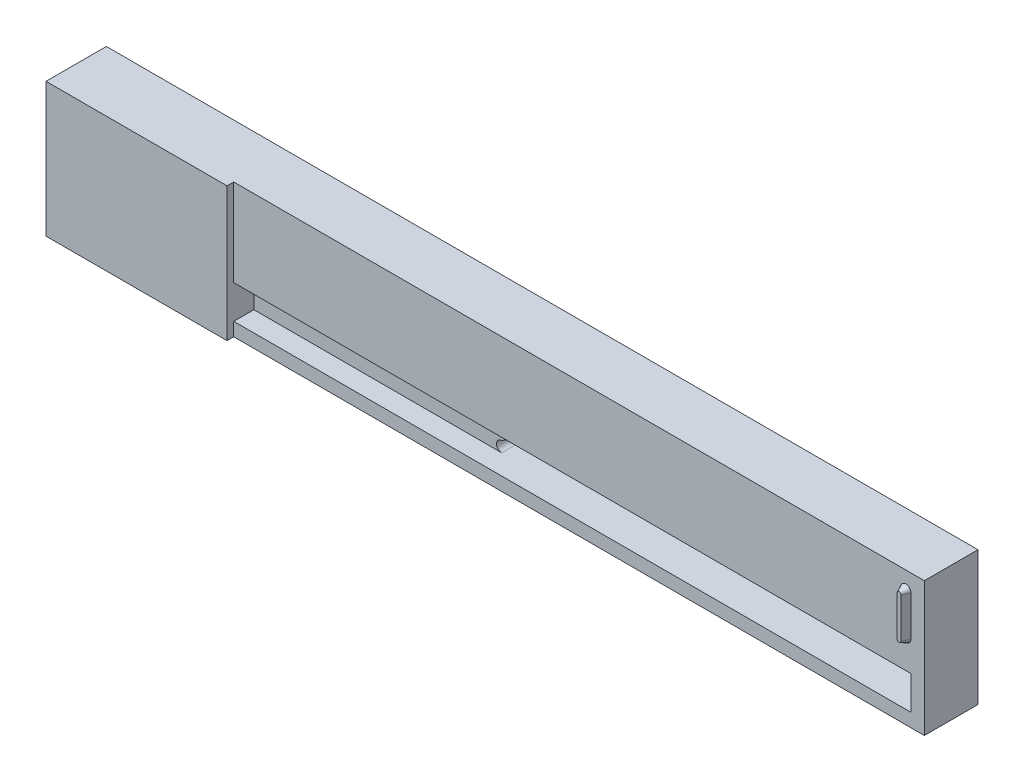
from build123d import *

# Parameters (mm, degrees)
SKETCH1_W           = 130
SKETCH1_H           = 20
BOSS_EXTRUDE1_DEPTH = 8
SKETCH2_W           = 3
SKETCH2_H           = 13.5
CUT_EXTRUDE1_DEPTH  = 7
SKETCH3_W           = 27
SKETCH3_H           = 20
BOSS_EXTRUDE2_DEPTH = 1
CUT_EXTRUDE3_DEPTH  = 2
CUT_EXTRUDE4_DEPTH  = 7
SKETCH7_R           = 3.15
CUT_EXTRUDE5_DEPTH  = 3
BOSS_EXTRUDE3_DEPTH = 1.5
CIRPATTERN1_COUNT   = 8
SKETCH9_R           = 1
CUT_EXTRUDE6_DEPTH  = 1
CUT_EXTRUDE6_DRAFT  = -25
SKETCH10_R          = 0.5
CUT_EXTRUDE7_DEPTH  = 3
SKETCH11_W          = 101
SKETCH11_H          = 5
CUT_EXTRUDE8_DEPTH  = 3
BOSS_EXTRUDE5_DEPTH = 5
LPATTERN2_COUNT     = 5
LPATTERN2_PITCH     = 1
BOSS_EXTRUDE6_DEPTH = 5
LPATTERN3_COUNT     = 3
LPATTERN3_PITCH     = 1
BOSS_EXTRUDE7_DEPTH = 1
BOSS_EXTRUDE7_TAPER = 25
SKETCH18_W          = 0.569871795
SKETCH18_H          = 4.640384615
SKETCH18_H_2        = 6.512820512
CUT_EXTRUDE10_DEPTH = 1


with BuildPart() as part:
    # Sketch1 → Boss-Extrude1 (new body)
    with BuildSketch(Plane.XY):
        Rectangle(SKETCH1_W, SKETCH1_H)
    extrude(amount=BOSS_EXTRUDE1_DEPTH)

    # Sketch2 → Cut-Extrude1 (cut)
    with BuildSketch(Plane.ZY.offset(65)):
        with Locations((3.1, 0.45)):
            Rectangle(SKETCH2_W, SKETCH2_H)
    extrude(amount=-CUT_EXTRUDE1_DEPTH, mode=Mode.SUBTRACT)

    # Sketch3 → Boss-Extrude2 (add)
    with BuildSketch(Plane.XY.offset(8)):
        with Locations((-51.5, 0)):
            Rectangle(SKETCH3_W, SKETCH3_H)
    extrude(amount=BOSS_EXTRUDE2_DEPTH)

    # Sketch4 → Cut-Extrude3 (cut)
    with BuildSketch(Plane(origin=(0, 0, 0), x_dir=(-1, 0, 0), z_dir=(0, 0, -1))):
        Polygon((-4, -9), (7, -9), (-4, -2), (-64, -2), (-64, -9), align=None)
    extrude(amount=-CUT_EXTRUDE3_DEPTH, mode=Mode.SUBTRACT)

    # Sketch6 → Cut-Extrude4 (cut)
    with BuildSketch(Plane(origin=(0, 0, 2), x_dir=(-1, 0, 0), z_dir=(0, 0, -1))):
        with BuildLine():
            Line((-63, -3), (-4, -3))
            Line((-4, -3), (1.029142106, -6.427272248))
            ThreePointArc((1.029142106, -6.427272248), (1.815505982, -7.213636124), (1.029142106, -8))
            Line((1.029142106, -8), (-4, -8))
            Line((-4, -8), (-63, -8))
            Line((-63, -8), (-63, -3))
        make_face()
    extrude(amount=-CUT_EXTRUDE4_DEPTH, mode=Mode.SUBTRACT)

    # Sketch7 → Cut-Extrude5 (cut)
    with BuildSketch(Plane(origin=(0, 0, 0), x_dir=(-1, 0, 0), z_dir=(0, 0, -1))):
        with Locations((-46, 4)):
            Circle(SKETCH7_R)
    extrude(amount=-CUT_EXTRUDE5_DEPTH, mode=Mode.SUBTRACT)

    # Sketch8 → Boss-Extrude3 (add)
    with BuildSketch(Plane(origin=(0, 0, 3), x_dir=(-1, 0, 0), z_dir=(0, 0, -1))):
        with BuildLine():
            Line((-46, 4), (-46, 6))
            ThreePointArc((-46, 6), (-45, 6.414213562), (-44.585786438, 5.414213562))
            Line((-44.585786438, 5.414213562), (-46, 4))
        make_face()
    boss_extrude3 = extrude(amount=BOSS_EXTRUDE3_DEPTH)

    # CirPattern1: Boss-Extrude3 ×8 about axis
    cirpattern1_axis = Axis((46, 4, 0), (0, 0, 1))
    for i in range(1, CIRPATTERN1_COUNT):
        add(boss_extrude3.rotate(cirpattern1_axis, i * 360 / CIRPATTERN1_COUNT))


with BuildPart() as cut_extrude6_tool:
    # Sketch9 → Cut-Extrude6 (with draft: the straight prism first)
    with BuildSketch(Plane(origin=(0, 0, 1.5), x_dir=(-1, 0, 0), z_dir=(0, 0, -1))):
        with Locations((-46, 4)):
            Circle(SKETCH9_R)
    extrude(amount=-CUT_EXTRUDE6_DEPTH)
    # Cut-Extrude6: the draft: its side faces are tilted about the plane it starts from
    cut_extrude6_sides = [cut_extrude6_tool.faces().sort_by_distance(p)[0] for p in [
        (47, 4, 2),
    ]]
    draft(cut_extrude6_sides, Plane(origin=(0, 0, 1.5), x_dir=(-1, 0, 0), z_dir=(0, 0, -1)), CUT_EXTRUDE6_DRAFT)


with BuildPart() as part_1:
    add(part.part)

    # Cut-Extrude6: cut by cut_extrude6_tool
    add(cut_extrude6_tool.part, mode=Mode.SUBTRACT)

    # Sketch10 → Cut-Extrude7 (cut)
    with BuildSketch(Plane(origin=(0, 0, 0), x_dir=(-1, 0, 0), z_dir=(0, 0, -1))):
        with Locations((-54.346544303, 4)):
            Circle(SKETCH10_R)
    extrude(amount=-CUT_EXTRUDE7_DEPTH, mode=Mode.SUBTRACT)

    # Sketch11 → Cut-Extrude8 (cut)
    with BuildSketch(Plane.XY.offset(8)):
        with Locations((12.5, -5.5)):
            Rectangle(SKETCH11_W, SKETCH11_H)
    extrude(amount=-CUT_EXTRUDE8_DEPTH, mode=Mode.SUBTRACT)

    # Sketch13 → Boss-Extrude5 (add)
    with BuildSketch(Plane.ZY.offset(58)):
        with BuildLine():
            Line((2.394077923, -5.196267403), (2.394077923, -4.196267403))
            Line((2.394077923, -4.196267403), (3.296543728, -4.196267403))
            ThreePointArc((3.296543728, -4.196267403), (3.796543728, -4.696267403), (3.296543728, -5.196267403))
            Line((3.296543728, -5.196267403), (2.394077923, -5.196267403))
        make_face()
    boss_extrude5 = extrude(amount=BOSS_EXTRUDE5_DEPTH)

    # LPattern2: Boss-Extrude5 ×5
    with Locations(*[(0, i * LPATTERN2_PITCH, 0) for i in range(1, LPATTERN2_COUNT)]):
        add(boss_extrude5)

    # Sketch15 → Boss-Extrude6 (add)
    with BuildSketch(Plane.ZY.offset(58)):
        with BuildLine():
            Line((2.394077923, 2.550445293), (2.394077923, 3.550445293))
            Line((2.394077923, 3.550445293), (3.394077923, 3.550445293))
            ThreePointArc((3.394077923, 3.550445293), (3.894077923, 3.050445293), (3.394077923, 2.550445293))
            Line((3.394077923, 2.550445293), (2.394077923, 2.550445293))
        make_face()
    boss_extrude6 = extrude(amount=BOSS_EXTRUDE6_DEPTH)

    # LPattern3: Boss-Extrude6 ×3
    with Locations(*[(0, i * LPATTERN3_PITCH, 0) for i in range(1, LPATTERN3_COUNT)]):
        add(boss_extrude6)

    # Sketch16 → Boss-Extrude7 (add)
    with BuildSketch(Plane.XY.offset(8)):
        with BuildLine():
            Line((63, 1.437655511), (63, 7.437655511))
            ThreePointArc((63, 7.437655511), (62.243555183, 8.194100328), (61.487110367, 7.437655511))
            Line((61.487110367, 7.437655511), (61.487110367, 1.437655511))
            ThreePointArc((61.487110367, 1.437655511), (62.243555183, 0.681210694), (63, 1.437655511))
        make_face()
    extrude(amount=BOSS_EXTRUDE7_DEPTH, taper=BOSS_EXTRUDE7_TAPER)

    # Sketch18 → Cut-Extrude10 (cut)
    # profile 1 of 6: a face of its own
    with BuildSketch(Plane(origin=(0, 0, 0), x_dir=(-1, 0, 0), z_dir=(0, 0, -1))):
        with BuildLine():
            add(Edge.make_bspline(
                [(33.830181075, 3.951769435), (33.865543891, 3.950129044), (33.934791076, 3.946916844), (34.034927433, 3.919409593), (34.126108012, 3.87278302), (34.206984756, 3.810227028), (34.276384608, 3.736658752), (34.324972468, 3.650913852), (34.356200672, 3.558278893), (34.359971766, 3.493662946), (34.361891812, 3.460763826)],
                knots=[0, 0, 0, 0, 1.055194115, 2.066272739, 3.074728998, 4.095836921, 5.109056067, 6.073838105, 7.019297344, 8, 8, 8, 8], degree=3))
            add(Edge.make_bspline(
                [(34.361891812, 3.460763826), (34.359928465, 3.428718727), (34.35604716, 3.365369358), (34.324996589, 3.274340344), (34.275970529, 3.189786858), (34.207029258, 3.116361427), (34.12609622, 3.053840016), (34.034930566, 3.007204276), (33.934790252, 2.979699455), (33.865543612, 2.97648692), (33.830181075, 2.974846358)],
                knots=[0, 0, 0, 0, 0.96129708, 1.900370562, 2.859976407, 3.87933698, 4.906634145, 5.921202961, 6.938410037, 8, 8, 8, 8], degree=3))
            add(Edge.make_bspline(
                [(33.830181075, 2.974846358), (33.795222919, 2.976424279), (33.727181435, 2.979495496), (33.628544449, 3.007743957), (33.538141333, 3.053855975), (33.457106855, 3.115952054), (33.389560648, 3.190237796), (33.340396543, 3.274288743), (33.309417684, 3.365382495), (33.305526715, 3.42872314), (33.303558479, 3.460763826)],
                knots=[0, 0, 0, 0, 1.054934014, 2.053291228, 3.073705704, 4.106921865, 5.123545215, 6.088680038, 7.033164197, 8, 8, 8, 8], degree=3))
            add(Edge.make_bspline(
                [(33.303558479, 3.460763826), (33.305483593, 3.493658367), (33.309264639, 3.558265322), (33.340419764, 3.65096631), (33.38915113, 3.736204178), (33.457151581, 3.810636156), (33.53812943, 3.872767159), (33.628547525, 3.918869939), (33.727180622, 3.947120798), (33.795222643, 3.950191684), (33.830181075, 3.951769435)],
                knots=[0, 0, 0, 0, 0.98631895, 1.937192651, 2.907499808, 3.917963147, 4.944918757, 5.95915025, 6.951458133, 8, 8, 8, 8], degree=3))
        make_face()
    # profile 2 of 6: a face of its own
    with BuildSketch(Plane(origin=(0, 0, 0), x_dir=(-1, 0, 0), z_dir=(0, 0, -1))):
        with Locations((33.832725146, -0.322269026)):
            Rectangle(SKETCH18_W, SKETCH18_H)
    # profile 3 of 6: a face of its own
    with BuildSketch(Plane(origin=(0, 0, 0), x_dir=(-1, 0, 0), z_dir=(0, 0, -1))):
        with BuildLine():
            Line((35.501635402, 1.997923281), (36.071507197, 1.997923281))
            Line((36.071507197, 1.997923281), (36.071507197, 1.160924082))
            add(Edge.make_bspline(
                [(36.071507197, 1.160924082), (36.132354049, 1.236838737), (36.250429489, 1.384153772), (36.447069637, 1.577775386), (36.654884999, 1.737333151), (36.872602919, 1.864521463), (37.100518952, 1.960400342), (37.337243813, 2.029644245), (37.58419478, 2.071163863), (37.752133115, 2.076588995), (37.837092133, 2.079333537)],
                knots=[0, 0, 0, 0, 1.12780773, 2.188550248, 3.19190651, 4.159438251, 5.104880172, 6.052711206, 7.014878035, 8, 8, 8, 8], degree=3))
            add(Edge.make_bspline(
                [(37.837092133, 2.079333537), (37.922963426, 2.076167254), (38.091034261, 2.069970074), (38.335741601, 2.020954078), (38.564293329, 1.9372334), (38.775874523, 1.822548644), (38.966605325, 1.679934042), (39.134108984, 1.513785781), (39.272653732, 1.32267603), (39.365540377, 1.145378304), (39.426728338, 0.988100063), (39.465249864, 0.853395245), (39.497963216, 0.703320885), (39.526323673, 0.538330488), (39.545513576, 0.357268057), (39.560648877, 0.160875815), (39.571495936, -0.050782621), (39.571926298, -0.197171217), (39.572148223, -0.272659652)],
                knots=[0, 0, 0, 0, 1.235846778, 2.418850247, 3.575807741, 4.728682307, 5.871620074, 6.994088408, 8.11269785, 9.256955736, 9.865816715, 10.540099792, 11.271859618, 12.076849838, 12.949306005, 13.892391288, 14.913166135, 16, 16, 16, 16], degree=3))
            Line((39.572148223, -0.272659652), (39.572148223, -2.642461334))
            Line((39.572148223, -2.642461334), (39.002276428, -2.642461334))
            Line((39.002276428, -2.642461334), (39.002276428, -0.459648834))
            add(Edge.make_bspline(
                [(39.002276428, -0.459648834), (39.001925893, -0.39647097), (39.00125538, -0.275622468), (38.999140564, -0.102595811), (38.994042772, 0.054315552), (38.986879404, 0.19473649), (38.976394592, 0.318532165), (38.965467818, 0.42595471), (38.952105646, 0.516867737), (38.940198646, 0.571595815), (38.934858559, 0.596140428)],
                knots=[0, 0, 0, 0, 1.430800155, 2.736877192, 3.918605307, 4.986035426, 5.920637409, 6.731861385, 7.431261377, 8, 8, 8, 8], degree=3))
            add(Edge.make_bspline(
                [(38.934858559, 0.596140428), (38.915580809, 0.668187864), (38.878477105, 0.806856886), (38.786794021, 0.994951783), (38.671016865, 1.154968495), (38.529687909, 1.28591769), (38.364172301, 1.387827637), (38.174929342, 1.458537526), (37.963785236, 1.502763043), (37.815277999, 1.507166554), (37.737873383, 1.509461743)],
                knots=[0, 0, 0, 0, 1.084156227, 2.086665306, 3.027808233, 3.945421172, 4.874247719, 5.839848303, 6.874090471, 8, 8, 8, 8], degree=3))
            add(Edge.make_bspline(
                [(37.737873383, 1.509461743), (37.692030586, 1.508598134), (37.601308874, 1.506889075), (37.466779639, 1.48974172), (37.336288639, 1.461695665), (37.20852626, 1.423833994), (37.086047834, 1.371832449), (36.964918335, 1.312814877), (36.84969892, 1.239248835), (36.737932756, 1.157260136), (36.633950948, 1.066402146), (36.537198106, 0.970527106), (36.450950555, 0.868427082), (36.372811672, 0.761747177), (36.30535968, 0.649022271), (36.246480506, 0.531339887), (36.196522888, 0.408545131), (36.171698575, 0.323318948), (36.15927763, 0.280675685)],
                knots=[0, 0, 0, 0, 1.023777757, 2.026029729, 3.023749952, 4.003683103, 4.997618607, 5.993177895, 7.010360494, 8.046726602, 9.087585522, 10.09234134, 11.086953743, 12.070360549, 13.043493632, 14.017870808, 15.008233677, 16, 16, 16, 16], degree=3))
            add(Edge.make_bspline(
                [(36.15927763, 0.280675685), (36.152129982, 0.249369816), (36.136569926, 0.181218579), (36.119763871, 0.069377989), (36.104510127, -0.05999868), (36.091743073, -0.206760455), (36.083931818, -0.371421171), (36.075414841, -0.55327762), (36.072314116, -0.753054949), (36.071783702, -0.892141163), (36.071507197, -0.964646831)],
                knots=[0, 0, 0, 0, 0.615963638, 1.340920617, 2.168419149, 3.115676021, 4.16674242, 5.331190069, 6.6087489, 8, 8, 8, 8], degree=3))
            Line((36.071507197, -0.964646831), (36.071507197, -2.642461334))
            Line((36.071507197, -2.642461334), (35.501635402, -2.642461334))
            Line((35.501635402, -2.642461334), (35.501635402, 1.997923281))
        make_face()
    # profile 4 of 6: a face of its own
    with BuildSketch(Plane(origin=(0, 0, 0), x_dir=(-1, 0, 0), z_dir=(0, 0, -1))):
        Polygon((41.44458412, 3.870359178), (42.014455915, 3.870359178), (42.014455915, 1.997923281), (42.828558479, 1.997923281), (42.828558479, 1.428051486), (42.014455915, 1.428051486), (42.014455915, -2.642461334), (41.44458412, -2.642461334), (41.44458412, 1.428051486), (40.630481556, 1.428051486), (40.630481556, 1.997923281), (41.44458412, 1.997923281), align=None)
    # profile 5 of 6: a face of its own
    with BuildSketch(Plane(origin=(0, 0, 0), x_dir=(-1, 0, 0), z_dir=(0, 0, -1))):
        with BuildLine():
            Line((47.613955114, -1.177076719), (48.120225146, -1.442932088))
            add(Edge.make_bspline(
                [(48.120225146, -1.442932088), (48.079881609, -1.51449356), (48.001389062, -1.653723847), (47.866404848, -1.845007365), (47.724904945, -2.017088221), (47.570502031, -2.165369165), (47.407815614, -2.294639535), (47.235943512, -2.40773816), (47.053990942, -2.504110332), (46.861949299, -2.585304204), (46.658205827, -2.647732858), (46.44226679, -2.691827659), (46.213718506, -2.71908416), (46.057061865, -2.722250344), (45.976845739, -2.723871591)],
                knots=[0, 0, 0, 0, 1.120438281, 2.179929193, 3.190490725, 4.156257408, 5.095198341, 6.022838206, 6.959905092, 7.901321166, 8.864066838, 9.862729781, 10.905609505, 12, 12, 12, 12], degree=3))
            add(Edge.make_bspline(
                [(45.976845739, -2.723871591), (45.887688151, -2.721790287), (45.713767526, -2.717730266), (45.460602556, -2.682728224), (45.222242754, -2.625628373), (44.998701521, -2.545862319), (44.790526292, -2.441672745), (44.597303312, -2.314746257), (44.418016458, -2.165734881), (44.258315393, -1.993347904), (44.114544348, -1.808867782), (43.987678932, -1.616633534), (43.88162045, -1.417128827), (43.795346429, -1.211623733), (43.725669031, -1.001413527), (43.677106583, -0.784585578), (43.649112611, -0.561726733), (43.644822832, -0.410964424), (43.642661043, -0.334989379)],
                knots=[0, 0, 0, 0, 1.145258523, 2.234067595, 3.276747158, 4.290159414, 5.277019952, 6.260822364, 7.254936242, 8.264827045, 9.274100331, 10.257902744, 11.220704747, 12.172965371, 13.118907548, 14.062713208, 15.023725156, 16, 16, 16, 16], degree=3))
            add(Edge.make_bspline(
                [(43.642661043, -0.334989379), (43.644582628, -0.26369733), (43.648390956, -0.122405902), (43.672395384, 0.086718728), (43.714937288, 0.289970349), (43.773314332, 0.487517848), (43.848700165, 0.679030462), (43.940924334, 0.864624749), (44.050130505, 1.044103217), (44.134445213, 1.157320331), (44.176915851, 1.214349563)],
                knots=[0, 0, 0, 0, 1.024358464, 2.0301432, 3.019427413, 4.004406732, 4.986367066, 5.972626655, 6.978780325, 8, 8, 8, 8], degree=3))
            add(Edge.make_bspline(
                [(44.176915851, 1.214349563), (44.234442647, 1.283054513), (44.347673936, 1.418288015), (44.539183323, 1.59597612), (44.746556537, 1.744826969), (44.967194772, 1.868211345), (45.203662375, 1.961962104), (45.452780661, 2.031825861), (45.717386224, 2.070974538), (45.898279982, 2.076504179), (45.990838127, 2.079333537)],
                knots=[0, 0, 0, 0, 1.030682036, 2.02871468, 2.997146059, 3.962720338, 4.930598197, 5.918074684, 6.934738563, 8, 8, 8, 8], degree=3))
            add(Edge.make_bspline(
                [(45.990838127, 2.079333537), (46.085993068, 2.076876906), (46.272665371, 2.072057555), (46.544866505, 2.02737835), (46.802423805, 1.956525858), (47.045234205, 1.856461124), (47.273322324, 1.727357366), (47.485205586, 1.567442882), (47.684507616, 1.381627209), (47.800456037, 1.238728243), (47.859457918, 1.166012223)],
                knots=[0, 0, 0, 0, 1.056321875, 2.072262726, 3.055038591, 4.01806755, 4.982017516, 5.957941055, 6.960871419, 8, 8, 8, 8], degree=3))
            add(Edge.make_bspline(
                [(47.859457918, 1.166012223), (47.899602506, 1.111214297), (47.979624468, 1.001983196), (48.079858492, 0.823872668), (48.166866909, 0.637526304), (48.236413853, 0.439931908), (48.292728376, 0.23343067), (48.333471462, 0.016546339), (48.357364912, -0.210656501), (48.362061549, -0.365463251), (48.364455915, -0.444384411)],
                knots=[0, 0, 0, 0, 0.94817472, 1.890038105, 2.849395472, 3.817997239, 4.812318967, 5.836947057, 6.897266129, 8, 8, 8, 8], degree=3))
            Line((48.364455915, -0.444384411), (44.212532838, -0.444384411))
            add(Edge.make_bspline(
                [(44.212532838, -0.444384411), (44.215326124, -0.505526682), (44.220819008, -0.625760492), (44.246427911, -0.801693198), (44.286793543, -0.969284833), (44.343524557, -1.127278352), (44.412225833, -1.277737298), (44.496382777, -1.419545565), (44.596784539, -1.552057238), (44.708772593, -1.676457616), (44.833426895, -1.787239283), (44.964568451, -1.88639322), (45.104075347, -1.96949766), (45.250847584, -2.036952603), (45.404647823, -2.089759776), (45.56552452, -2.125805679), (45.733161102, -2.149948573), (45.84743522, -2.152633109), (45.905611764, -2.153999796)],
                knots=[0, 0, 0, 0, 1.094153842, 2.151609401, 3.174256925, 4.172055639, 5.149267565, 6.128595816, 7.11444997, 8.118368179, 9.117203808, 10.09244225, 11.054858984, 12.015122123, 12.976791628, 13.957293641, 14.960065497, 16, 16, 16, 16], degree=3))
            add(Edge.make_bspline(
                [(45.905611764, -2.153999796), (45.962491704, -2.152896607), (46.075352414, -2.15070767), (46.243429398, -2.129422631), (46.408782541, -2.095005131), (46.570727468, -2.048033292), (46.725977431, -1.990743861), (46.8697515, -1.92161439), (47.001977034, -1.845142707), (47.125560674, -1.757676582), (47.245432333, -1.650618871), (47.36434513, -1.517022635), (47.491847058, -1.359020977), (47.571656748, -1.240102412), (47.613955114, -1.177076719)],
                knots=[0, 0, 0, 0, 0.99110716, 1.966546729, 2.947904876, 3.932708344, 4.903319531, 5.828989031, 6.710028674, 7.56322171, 8.463672341, 9.504779593, 10.677557249, 12, 12, 12, 12], degree=3))
        make_face()
        with BuildLine():
            add(Edge.make_bspline(
                [(47.79458412, 0.125487384), (47.773725958, 0.20107574), (47.733580711, 0.346558995), (47.649694736, 0.548018896), (47.555222084, 0.727066945), (47.443422657, 0.882332851), (47.31675154, 1.020224938), (47.170438137, 1.140727229), (47.006361588, 1.248527461), (46.825370004, 1.339518425), (46.633705622, 1.416970025), (46.433034388, 1.468904164), (46.228278116, 1.504481476), (46.089785911, 1.507794559), (46.020094937, 1.509461743)],
                knots=[0, 0, 0, 0, 1.154881502, 2.222775134, 3.210006277, 4.132804581, 5.035138423, 5.962687519, 6.919655026, 7.923214229, 8.944639381, 9.960483929, 10.97369054, 12, 12, 12, 12], degree=3))
            add(Edge.make_bspline(
                [(46.020094937, 1.509461743), (45.963218099, 1.508351996), (45.850784547, 1.506158259), (45.685138323, 1.485348167), (45.526062298, 1.450949592), (45.372382705, 1.403841742), (45.226113415, 1.341051849), (45.084245764, 1.26742228), (44.950387045, 1.177539693), (44.866673552, 1.109034342), (44.824381796, 1.074425685)],
                knots=[0, 0, 0, 0, 1.04873581, 2.073130211, 3.073294108, 4.04793562, 5.032784715, 6.005352987, 6.992311501, 8, 8, 8, 8], degree=3))
            add(Edge.make_bspline(
                [(44.824381796, 1.074425685), (44.794095413, 1.047040284), (44.732803156, 0.991618906), (44.650905352, 0.896134488), (44.572491066, 0.79317094), (44.501128582, 0.678789071), (44.435673532, 0.554291372), (44.374423288, 0.420727948), (44.319293654, 0.277085269), (44.288276426, 0.1769867), (44.272318495, 0.125487384)],
                knots=[0, 0, 0, 0, 0.879870761, 1.780643979, 2.707998968, 3.669668524, 4.684282772, 5.740141944, 6.837334558, 8, 8, 8, 8], degree=3))
            Line((44.272318495, 0.125487384), (47.79458412, 0.125487384))
        make_face(mode=Mode.SUBTRACT)
    # profile 6 of 6: a face of its own
    with BuildSketch(Plane(origin=(0, 0, 0), x_dir=(-1, 0, 0), z_dir=(0, 0, -1))):
        with Locations((49.707725146, 0.613948922)):
            Rectangle(SKETCH18_W, SKETCH18_H_2)
    extrude(amount=-CUT_EXTRUDE10_DEPTH, mode=Mode.SUBTRACT)


solid = part_1.part
